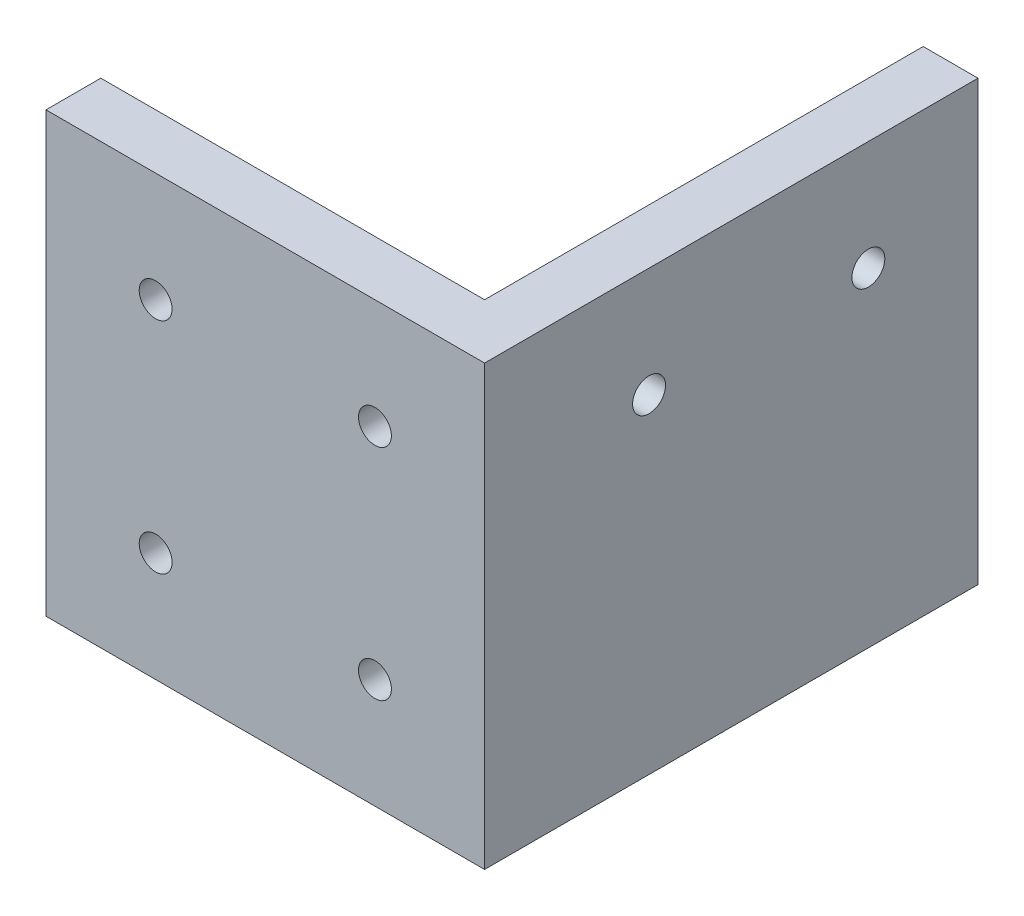
from build123d import *

# Parameters (mm, degrees)
BOSS_EXTRUDE1_DEPTH  = 597.1
SKETCH2_W            = 65.2
SKETCH2_H            = 400
CUT_EXTRUDE1_DEPTH   = 800.095369778
BOSS_EXTRUDE2_DEPTH  = 8
SKETCH4_W            = 525
SKETCH4_H            = 597.1
BOSS_EXTRUDE3_DEPTH  = 7
SKETCH5_W            = 365
SKETCH5_H            = 597.1
CUT_EXTRUDE2_DEPTH   = 10
CUT_EXTRUDE3_REACH   = 802.736
SKETCH6_R            = 2.125
SKETCH7_W            = 20
SKETCH7_H            = 597.1
CUT_EXTRUDE4_DEPTH   = 5
SKETCH8_W            = 55.055493435
SKETCH8_H            = 20
CUT_EXTRUDE6_DEPTH   = 60
BOSS_EXTRUDE4_REACH  = 799.121
SKETCH13_W           = 40
SKETCH13_H           = 15
SKETCH14_W           = 20
SKETCH14_H           = 597.1
CUT_EXTRUDE7_DEPTH   = 5
CUT_EXTRUDE8_REACH   = 802.736
SKETCH15_R           = 1.33
SKETCH16_W           = 35
SKETCH16_H           = 15
CUT_EXTRUDE9_DEPTH   = 60
SKETCH17_W           = 60
SKETCH17_H           = 150
CUT_EXTRUDE10_DEPTH  = 40
SKETCH18_W           = 12
SKETCH18_H           = 16
CUT_EXTRUDE11_DEPTH  = 800.298073312
SKETCH19_W           = 8
SKETCH19_H           = 7
CUT_EXTRUDE12_DEPTH  = 10
CUT_EXTRUDE13_REACH  = 802.736
SKETCH20_R           = 2.75986214
SKETCH20_R_2         = 2.757960919
SKETCH20_R_3         = 2.776094021
SKETCH20_R_4         = 2.751394876
CUT_EXTRUDE14_REACH  = 802.736
SKETCH21_R           = 1.643359813
SKETCH21_R_2         = 1.638913006
SKETCH21_R_3         = 1.644479807
SKETCH21_R_4         = 1.70596398
SKETCH21_R_5         = 1.645380558
SKETCH21_R_6         = 1.646601879
SKETCH21_R_7         = 1.661334202
SKETCH21_R_8         = 1.701244733
CUT_EXTRUDE15_REACH  = 752.719
SKETCH22_W           = 15
SKETCH22_H           = 20
CUT_EXTRUDE16_REACH  = 802.736
SKETCH24_R           = 1.5
SKETCH27_W           = 35
SKETCH27_H           = 15
CUT_EXTRUDE17_DEPTH  = 60
CUT_EXTRUDE18_START  = -60
SKETCH28_W           = 35
SKETCH28_H           = 15
SKETCH28_R           = 1.5
CUT_EXTRUDE18_DEPTH  = 60
SKETCH29_W           = 60
SKETCH29_H           = 150
CUT_EXTRUDE19_DEPTH  = 40
CUT_EXTRUDE20_REACH  = 802.736
SKETCH33_R           = 2.5
SKETCH37_W           = 55
SKETCH37_H           = 20
CUT_EXTRUDE21_DEPTH  = 60
SKETCH39_W           = 5
SKETCH39_H           = 40
BOSS_EXTRUDE6_DEPTH  = 40
SKETCH41_R           = 1.5
CUT_EXTRUDE22_DEPTH  = 799.501603004
SKETCH42_W           = 35
SKETCH42_H           = 15
BOSS_EXTRUDE7_DEPTH  = 60
SKETCH43_W           = 41.147889502
SKETCH43_H           = 41.618954825
SKETCH43_W_2         = 42.4363484
SKETCH43_H_2         = 40
BOSS_EXTRUDE8_DEPTH  = 20
SKETCH44_W           = 49.636924656
SKETCH44_H           = 46.225017069
SKETCH44_W_2         = 46.873520021
BOSS_EXTRUDE9_DEPTH  = 20
SKETCH45_W           = 35
SKETCH45_H           = 15
BOSS_EXTRUDE10_DEPTH = 60
SKETCH46_W           = 5
SKETCH46_H           = 40
BOSS_EXTRUDE11_DEPTH = 40
SKETCH47_R           = 1.5
CUT_EXTRUDE23_DEPTH  = 826.351325194
FILLET1_R            = 5
FILLET2_R            = 5
SKETCH51_W           = 40
SKETCH51_H           = 40
BOSS_EXTRUDE12_DEPTH = 5
SKETCH52_R           = 3
CUT_EXTRUDE26_DEPTH  = 831.93526222
SKETCH53_R           = 3.280439698
BOSS_EXTRUDE13_DEPTH = 570
CUT_EXTRUDE27_START  = -40
SKETCH54_R           = 3.280439698
CUT_EXTRUDE27_DEPTH  = 40
SKETCH55_W           = 485
SKETCH55_H           = 14.478767201
CUT_EXTRUDE28_DEPTH  = 40
SKETCH57_W           = 723.186896727
SKETCH57_H           = 160.707941424
CUT_EXTRUDE30_DEPTH  = 828.51338962
SKETCH60_W           = 40
SKETCH60_H           = 40
BOSS_EXTRUDE15_DEPTH = 5
SKETCH61_R           = 3
CUT_EXTRUDE31_DEPTH  = 5
SKETCH62_W           = 40
SKETCH62_H           = 40
CUT_EXTRUDE32_DEPTH  = 5
SKETCH63_R           = 4.70093443
SKETCH63_R_2         = 1.5
SKETCH63_R_3         = 5.7398541
BOSS_EXTRUDE16_DEPTH = 5
SKETCH64_R           = 3.5
CUT_EXTRUDE33_DEPTH  = 1.5


with BuildPart() as part:
    # Sketch1 → Boss-Extrude1 (new body)
    with BuildSketch(Plane.XY):
        Polygon((0, 95), (0, 0), (237.916666667, 0), (262.5, 0), (262.5, 15), (80, 15), (80, 80), (70, 80), (70, 75), (50, 75), (50, 80), (40, 80), (40, 75), (20, 75), (20, 95), align=None)
        Polygon((262.5, 15), (262.5, 0), (287.083333333, 0), (525, 0), (525, 95), (505, 95), (505, 75), (485, 75), (485, 80), (475, 80), (475, 75), (455, 75), (455, 80), (445, 80), (445, 15), align=None)
    extrude(amount=BOSS_EXTRUDE1_DEPTH)

    # Sketch2 → Cut-Extrude1 (cut, through all)
    with BuildSketch(Plane(origin=(0, 15, 0), x_dir=(1, 0, 0), z_dir=(0, 1, 0))):
        with Locations((219.9, -200)):
            Rectangle(SKETCH2_W, SKETCH2_H)
        with Locations((305.1, -397.1)):
            Rectangle(SKETCH2_W, SKETCH2_H)
    extrude(amount=-CUT_EXTRUDE1_DEPTH, mode=Mode.SUBTRACT)

    # Sketch3 → Boss-Extrude2 (add)
    with BuildSketch(Plane(origin=(0, 15, 0), x_dir=(1, 0, 0), z_dir=(0, 1, 0))):
        Polygon((252.5, -400), (187.3, -400), (187.3, 0), (80, 0), (80, -597.1), (272.5, -597.1), (272.5, -197.1), (337.7, -197.1), (337.7, -597.1), (445, -597.1), (445, 0), (252.5, 0), align=None)
    extrude(amount=BOSS_EXTRUDE2_DEPTH)

    # Sketch4 → Boss-Extrude3 (add)
    with BuildSketch(Plane.XZ):
        with Locations((262.5, 298.55)):
            Rectangle(SKETCH4_W, SKETCH4_H)
    extrude(amount=BOSS_EXTRUDE3_DEPTH)

    # Sketch5 → Cut-Extrude2 (cut)
    with BuildSketch(Plane(origin=(0, 23, 0), x_dir=(1, 0, 0), z_dir=(0, 1, 0))):
        with Locations((262.5, -298.55)):
            Rectangle(SKETCH5_W, SKETCH5_H)
    extrude(amount=-CUT_EXTRUDE2_DEPTH, mode=Mode.SUBTRACT)

    # Sketch6 → Cut-Extrude3 (cut, up to next)
    with BuildSketch(Plane(origin=(525, 0, 0), x_dir=(0, 0, -1), z_dir=(1, 0, 0)), mode=Mode.PRIVATE) as cut_extrude3_sk1:
        with Locations((-318.55, 79)):
            Circle(SKETCH6_R)
    cut_extrude3_tool1 = extrude(cut_extrude3_sk1.sketch, amount=-CUT_EXTRUDE3_REACH, mode=Mode.PRIVATE) & part.part
    # Sketch6 → Cut-Extrude3 (cut, up to next)
    with BuildSketch(Plane(origin=(525, 0, 0), x_dir=(0, 0, -1), z_dir=(1, 0, 0)), mode=Mode.PRIVATE) as cut_extrude3_sk2:
        with Locations((-318.55, 63)):
            Circle(SKETCH6_R)
    cut_extrude3_tool2 = extrude(cut_extrude3_sk2.sketch, amount=-CUT_EXTRUDE3_REACH, mode=Mode.PRIVATE) & part.part
    # Sketch6 → Cut-Extrude3 (cut, up to next)
    with BuildSketch(Plane(origin=(525, 0, 0), x_dir=(0, 0, -1), z_dir=(1, 0, 0)), mode=Mode.PRIVATE) as cut_extrude3_sk3:
        with Locations((-278.55, 63)):
            Circle(SKETCH6_R)
    cut_extrude3_tool3 = extrude(cut_extrude3_sk3.sketch, amount=-CUT_EXTRUDE3_REACH, mode=Mode.PRIVATE) & part.part
    # Sketch6 → Cut-Extrude3 (cut, up to next)
    with BuildSketch(Plane(origin=(525, 0, 0), x_dir=(0, 0, -1), z_dir=(1, 0, 0)), mode=Mode.PRIVATE) as cut_extrude3_sk4:
        with Locations((-278.55, 79)):
            Circle(SKETCH6_R)
    cut_extrude3_tool4 = extrude(cut_extrude3_sk4.sketch, amount=-CUT_EXTRUDE3_REACH, mode=Mode.PRIVATE) & part.part
    add(cut_extrude3_tool1.solids().sort_by_distance((525, 79, 318.55))[0], mode=Mode.SUBTRACT)
    add(cut_extrude3_tool2.solids().sort_by_distance((525, 63, 318.55))[0], mode=Mode.SUBTRACT)
    add(cut_extrude3_tool3.solids().sort_by_distance((525, 63, 278.55))[0], mode=Mode.SUBTRACT)
    add(cut_extrude3_tool4.solids().sort_by_distance((525, 79, 278.55))[0], mode=Mode.SUBTRACT)

    # Sketch7 → Cut-Extrude4 (cut)
    with BuildSketch(Plane(origin=(0, 75, 0), x_dir=(1, 0, 0), z_dir=(0, 1, 0))):
        with Locations((495, -298.55)):
            Rectangle(SKETCH7_W, SKETCH7_H)
    extrude(amount=-CUT_EXTRUDE4_DEPTH, mode=Mode.SUBTRACT)

    # Sketch8 → Cut-Extrude6 (cut)
    with BuildSketch(Plane.ZY.offset(-445)):
        with Locations((297.395302375, 60)):
            Rectangle(SKETCH8_W, SKETCH8_H)
    extrude(amount=-CUT_EXTRUDE6_DEPTH, mode=Mode.SUBTRACT)

    # Sketch13 → Boss-Extrude4 (add, up to next)
    with BuildSketch(Plane(origin=(0, 50, 0), x_dir=(1, 0, 0), z_dir=(0, 1, 0)), mode=Mode.PRIVATE) as boss_extrude4_sk1:
        with Locations((465, -297.800707188)):
            Rectangle(SKETCH13_W, SKETCH13_H)
    boss_extrude4_tool1 = extrude(boss_extrude4_sk1.sketch, amount=BOSS_EXTRUDE4_REACH, mode=Mode.PRIVATE) - part.part
    add(boss_extrude4_tool1.solids().sort_by_distance((465, 50, 297.800707))[0])

    # Sketch14 → Cut-Extrude7 (cut)
    with BuildSketch(Plane(origin=(0, 75, 0), x_dir=(1, 0, 0), z_dir=(0, 1, 0))):
        with Locations((30, -298.55)):
            Rectangle(SKETCH14_W, SKETCH14_H)
    extrude(amount=-CUT_EXTRUDE7_DEPTH, mode=Mode.SUBTRACT)

    # Sketch15 → Cut-Extrude8 (cut, up to next)
    with BuildSketch(Plane.ZY, mode=Mode.PRIVATE) as cut_extrude8_sk1:
        with Locations((13.5, 82.3)):
            Circle(SKETCH15_R)
    cut_extrude8_tool1 = extrude(cut_extrude8_sk1.sketch, amount=-CUT_EXTRUDE8_REACH, mode=Mode.PRIVATE) & part.part
    # Sketch15 → Cut-Extrude8 (cut, up to next)
    with BuildSketch(Plane.ZY, mode=Mode.PRIVATE) as cut_extrude8_sk2:
        with Locations((33.5, 82.3)):
            Circle(SKETCH15_R)
    cut_extrude8_tool2 = extrude(cut_extrude8_sk2.sketch, amount=-CUT_EXTRUDE8_REACH, mode=Mode.PRIVATE) & part.part
    # Sketch15 → Cut-Extrude8 (cut, up to next)
    with BuildSketch(Plane.ZY, mode=Mode.PRIVATE) as cut_extrude8_sk3:
        with Locations((13.5, 62.3)):
            Circle(SKETCH15_R)
    cut_extrude8_tool3 = extrude(cut_extrude8_sk3.sketch, amount=-CUT_EXTRUDE8_REACH, mode=Mode.PRIVATE) & part.part
    # Sketch15 → Cut-Extrude8 (cut, up to next)
    with BuildSketch(Plane.ZY, mode=Mode.PRIVATE) as cut_extrude8_sk4:
        with Locations((33.5, 62.3)):
            Circle(SKETCH15_R)
    cut_extrude8_tool4 = extrude(cut_extrude8_sk4.sketch, amount=-CUT_EXTRUDE8_REACH, mode=Mode.PRIVATE) & part.part
    # Sketch15 → Cut-Extrude8 (cut, up to next)
    with BuildSketch(Plane.ZY, mode=Mode.PRIVATE) as cut_extrude8_sk5:
        with Locations((563.6, 82.3)):
            Circle(SKETCH15_R)
    cut_extrude8_tool5 = extrude(cut_extrude8_sk5.sketch, amount=-CUT_EXTRUDE8_REACH, mode=Mode.PRIVATE) & part.part
    # Sketch15 → Cut-Extrude8 (cut, up to next)
    with BuildSketch(Plane.ZY, mode=Mode.PRIVATE) as cut_extrude8_sk6:
        with Locations((583.6, 62.3)):
            Circle(SKETCH15_R)
    cut_extrude8_tool6 = extrude(cut_extrude8_sk6.sketch, amount=-CUT_EXTRUDE8_REACH, mode=Mode.PRIVATE) & part.part
    # Sketch15 → Cut-Extrude8 (cut, up to next)
    with BuildSketch(Plane.ZY, mode=Mode.PRIVATE) as cut_extrude8_sk7:
        with Locations((563.6, 62.3)):
            Circle(SKETCH15_R)
    cut_extrude8_tool7 = extrude(cut_extrude8_sk7.sketch, amount=-CUT_EXTRUDE8_REACH, mode=Mode.PRIVATE) & part.part
    # Sketch15 → Cut-Extrude8 (cut, up to next)
    with BuildSketch(Plane.ZY, mode=Mode.PRIVATE) as cut_extrude8_sk8:
        with Locations(Location((583.6, 82.3, 0), (0, 0, 90))):
            Circle(SKETCH15_R)
    cut_extrude8_tool8 = extrude(cut_extrude8_sk8.sketch, amount=-CUT_EXTRUDE8_REACH, mode=Mode.PRIVATE) & part.part
    add(cut_extrude8_tool1.solids().sort_by_distance((0, 82.3, 13.5))[0], mode=Mode.SUBTRACT)
    add(cut_extrude8_tool2.solids().sort_by_distance((0, 82.3, 33.5))[0], mode=Mode.SUBTRACT)
    add(cut_extrude8_tool3.solids().sort_by_distance((0, 62.3, 13.5))[0], mode=Mode.SUBTRACT)
    add(cut_extrude8_tool4.solids().sort_by_distance((0, 62.3, 33.5))[0], mode=Mode.SUBTRACT)
    add(cut_extrude8_tool5.solids().sort_by_distance((0, 82.3, 563.6))[0], mode=Mode.SUBTRACT)
    add(cut_extrude8_tool6.solids().sort_by_distance((0, 62.3, 583.6))[0], mode=Mode.SUBTRACT)
    add(cut_extrude8_tool7.solids().sort_by_distance((0, 62.3, 563.6))[0], mode=Mode.SUBTRACT)
    add(cut_extrude8_tool8.solids().sort_by_distance((0, 82.3, 583.6))[0], mode=Mode.SUBTRACT)

    # Sketch16 → Cut-Extrude9 (cut)
    with BuildSketch(Plane(origin=(80, 0, 0), x_dir=(0, 0, -1), z_dir=(1, 0, 0))):
        with Locations((-574.6, 62.5)):
            Rectangle(SKETCH16_W, SKETCH16_H)
        with Locations((-22.5, 62.5)):
            Rectangle(SKETCH16_W, SKETCH16_H)
    extrude(amount=-CUT_EXTRUDE9_DEPTH, mode=Mode.SUBTRACT)

    # Sketch17 → Cut-Extrude10 (cut)
    with BuildSketch(Plane.XZ.offset(7)):
        with Locations((495, 298.55)):
            Rectangle(SKETCH17_W, SKETCH17_H)
    extrude(amount=-CUT_EXTRUDE10_DEPTH, mode=Mode.SUBTRACT)

    # Sketch18 → Cut-Extrude11 (cut, through all)
    with BuildSketch(Plane(origin=(0, 13, 0), x_dir=(1, 0, 0), z_dir=(0, 1, 0))):
        with Locations((421, -294.05)):
            Rectangle(SKETCH18_W, SKETCH18_H)
    extrude(amount=-CUT_EXTRUDE11_DEPTH, mode=Mode.SUBTRACT)

    # Sketch19 → Cut-Extrude12 (cut)
    with BuildSketch(Plane(origin=(0, 13, 0), x_dir=(1, 0, 0), z_dir=(0, 1, 0))):
        with Locations((421, -282.55)):
            Rectangle(SKETCH19_W, SKETCH19_H)
        with Locations((421, -305.55)):
            Rectangle(SKETCH19_W, SKETCH19_H)
    extrude(amount=-CUT_EXTRUDE12_DEPTH, mode=Mode.SUBTRACT)

    # Sketch20 → Cut-Extrude13 (cut, up to next)
    with BuildSketch(Plane(origin=(525, 0, 0), x_dir=(0, 0, -1), z_dir=(1, 0, 0)), mode=Mode.PRIVATE) as cut_extrude13_sk1:
        with Locations((-318.55, 79)):
            Circle(SKETCH20_R)
    cut_extrude13_tool1 = extrude(cut_extrude13_sk1.sketch, amount=-CUT_EXTRUDE13_REACH, mode=Mode.PRIVATE) & part.part
    # Sketch20 → Cut-Extrude13 (cut, up to next)
    with BuildSketch(Plane(origin=(525, 0, 0), x_dir=(0, 0, -1), z_dir=(1, 0, 0)), mode=Mode.PRIVATE) as cut_extrude13_sk2:
        with Locations((-318.55, 63)):
            Circle(SKETCH20_R_2)
    cut_extrude13_tool2 = extrude(cut_extrude13_sk2.sketch, amount=-CUT_EXTRUDE13_REACH, mode=Mode.PRIVATE) & part.part
    # Sketch20 → Cut-Extrude13 (cut, up to next)
    with BuildSketch(Plane(origin=(525, 0, 0), x_dir=(0, 0, -1), z_dir=(1, 0, 0)), mode=Mode.PRIVATE) as cut_extrude13_sk3:
        with Locations((-278.55, 63)):
            Circle(SKETCH20_R_3)
    cut_extrude13_tool3 = extrude(cut_extrude13_sk3.sketch, amount=-CUT_EXTRUDE13_REACH, mode=Mode.PRIVATE) & part.part
    # Sketch20 → Cut-Extrude13 (cut, up to next)
    with BuildSketch(Plane(origin=(525, 0, 0), x_dir=(0, 0, -1), z_dir=(1, 0, 0)), mode=Mode.PRIVATE) as cut_extrude13_sk4:
        with Locations((-278.55, 79)):
            Circle(SKETCH20_R_4)
    cut_extrude13_tool4 = extrude(cut_extrude13_sk4.sketch, amount=-CUT_EXTRUDE13_REACH, mode=Mode.PRIVATE) & part.part
    add(cut_extrude13_tool1.solids().sort_by_distance((525, 79, 318.55))[0], mode=Mode.SUBTRACT)
    add(cut_extrude13_tool2.solids().sort_by_distance((525, 63, 318.55))[0], mode=Mode.SUBTRACT)
    add(cut_extrude13_tool3.solids().sort_by_distance((525, 63, 278.55))[0], mode=Mode.SUBTRACT)
    add(cut_extrude13_tool4.solids().sort_by_distance((525, 79, 278.55))[0], mode=Mode.SUBTRACT)

    # Sketch21 → Cut-Extrude14 (cut, up to next)
    with BuildSketch(Plane.ZY, mode=Mode.PRIVATE) as cut_extrude14_sk1:
        with Locations((13.5, 82.3)):
            Circle(SKETCH21_R)
    cut_extrude14_tool1 = extrude(cut_extrude14_sk1.sketch, amount=-CUT_EXTRUDE14_REACH, mode=Mode.PRIVATE) & part.part
    # Sketch21 → Cut-Extrude14 (cut, up to next)
    with BuildSketch(Plane.ZY, mode=Mode.PRIVATE) as cut_extrude14_sk2:
        with Locations((13.5, 62.3)):
            Circle(SKETCH21_R_2)
    cut_extrude14_tool2 = extrude(cut_extrude14_sk2.sketch, amount=-CUT_EXTRUDE14_REACH, mode=Mode.PRIVATE) & part.part
    # Sketch21 → Cut-Extrude14 (cut, up to next)
    with BuildSketch(Plane.ZY, mode=Mode.PRIVATE) as cut_extrude14_sk3:
        with Locations((33.5, 62.3)):
            Circle(SKETCH21_R_3)
    cut_extrude14_tool3 = extrude(cut_extrude14_sk3.sketch, amount=-CUT_EXTRUDE14_REACH, mode=Mode.PRIVATE) & part.part
    # Sketch21 → Cut-Extrude14 (cut, up to next)
    with BuildSketch(Plane.ZY, mode=Mode.PRIVATE) as cut_extrude14_sk4:
        with Locations((33.5, 82.3)):
            Circle(SKETCH21_R_4)
    cut_extrude14_tool4 = extrude(cut_extrude14_sk4.sketch, amount=-CUT_EXTRUDE14_REACH, mode=Mode.PRIVATE) & part.part
    # Sketch21 → Cut-Extrude14 (cut, up to next)
    with BuildSketch(Plane.ZY, mode=Mode.PRIVATE) as cut_extrude14_sk5:
        with Locations((563.6, 62.3)):
            Circle(SKETCH21_R_5)
    cut_extrude14_tool5 = extrude(cut_extrude14_sk5.sketch, amount=-CUT_EXTRUDE14_REACH, mode=Mode.PRIVATE) & part.part
    # Sketch21 → Cut-Extrude14 (cut, up to next)
    with BuildSketch(Plane.ZY, mode=Mode.PRIVATE) as cut_extrude14_sk6:
        with Locations((583.6, 62.3)):
            Circle(SKETCH21_R_6)
    cut_extrude14_tool6 = extrude(cut_extrude14_sk6.sketch, amount=-CUT_EXTRUDE14_REACH, mode=Mode.PRIVATE) & part.part
    # Sketch21 → Cut-Extrude14 (cut, up to next)
    with BuildSketch(Plane.ZY, mode=Mode.PRIVATE) as cut_extrude14_sk7:
        with Locations((583.6, 82.3)):
            Circle(SKETCH21_R_7)
    cut_extrude14_tool7 = extrude(cut_extrude14_sk7.sketch, amount=-CUT_EXTRUDE14_REACH, mode=Mode.PRIVATE) & part.part
    # Sketch21 → Cut-Extrude14 (cut, up to next)
    with BuildSketch(Plane.ZY, mode=Mode.PRIVATE) as cut_extrude14_sk8:
        with Locations((563.6, 82.3)):
            Circle(SKETCH21_R_8)
    cut_extrude14_tool8 = extrude(cut_extrude14_sk8.sketch, amount=-CUT_EXTRUDE14_REACH, mode=Mode.PRIVATE) & part.part
    add(cut_extrude14_tool1.solids().sort_by_distance((0, 82.3, 13.5))[0], mode=Mode.SUBTRACT)
    add(cut_extrude14_tool2.solids().sort_by_distance((0, 62.3, 13.5))[0], mode=Mode.SUBTRACT)
    add(cut_extrude14_tool3.solids().sort_by_distance((0, 62.3, 33.5))[0], mode=Mode.SUBTRACT)
    add(cut_extrude14_tool4.solids().sort_by_distance((0, 82.3, 33.5))[0], mode=Mode.SUBTRACT)
    add(cut_extrude14_tool5.solids().sort_by_distance((0, 62.3, 563.6))[0], mode=Mode.SUBTRACT)
    add(cut_extrude14_tool6.solids().sort_by_distance((0, 62.3, 583.6))[0], mode=Mode.SUBTRACT)
    add(cut_extrude14_tool7.solids().sort_by_distance((0, 82.3, 583.6))[0], mode=Mode.SUBTRACT)
    add(cut_extrude14_tool8.solids().sort_by_distance((0, 82.3, 563.6))[0], mode=Mode.SUBTRACT)

    # Sketch22 → Cut-Extrude15 (cut, up to next)
    with BuildSketch(Plane.ZY.offset(-445), mode=Mode.PRIVATE) as cut_extrude15_sk1:
        with Locations((297.800707188, 60)):
            Rectangle(SKETCH22_W, SKETCH22_H)
    cut_extrude15_tool1 = extrude(cut_extrude15_sk1.sketch, amount=-CUT_EXTRUDE15_REACH, mode=Mode.PRIVATE) & part.part
    add(cut_extrude15_tool1.solids().sort_by_distance((445, 60, 297.800707))[0], mode=Mode.SUBTRACT)

    # Sketch24 → Cut-Extrude16 (cut, up to next)
    with BuildSketch(Plane(origin=(525, 0, 0), x_dir=(0, 0, -1), z_dir=(1, 0, 0)), mode=Mode.PRIVATE) as cut_extrude16_sk1:
        with Locations((-583.6, 82.3)):
            Circle(SKETCH24_R)
    cut_extrude16_tool1 = extrude(cut_extrude16_sk1.sketch, amount=-CUT_EXTRUDE16_REACH, mode=Mode.PRIVATE) & part.part
    # Sketch24 → Cut-Extrude16 (cut, up to next)
    with BuildSketch(Plane(origin=(525, 0, 0), x_dir=(0, 0, -1), z_dir=(1, 0, 0)), mode=Mode.PRIVATE) as cut_extrude16_sk2:
        with Locations((-563.6, 82.3)):
            Circle(SKETCH24_R)
    cut_extrude16_tool2 = extrude(cut_extrude16_sk2.sketch, amount=-CUT_EXTRUDE16_REACH, mode=Mode.PRIVATE) & part.part
    # Sketch24 → Cut-Extrude16 (cut, up to next)
    with BuildSketch(Plane(origin=(525, 0, 0), x_dir=(0, 0, -1), z_dir=(1, 0, 0)), mode=Mode.PRIVATE) as cut_extrude16_sk3:
        with Locations((-583.6, 62.3)):
            Circle(SKETCH24_R)
    cut_extrude16_tool3 = extrude(cut_extrude16_sk3.sketch, amount=-CUT_EXTRUDE16_REACH, mode=Mode.PRIVATE) & part.part
    # Sketch24 → Cut-Extrude16 (cut, up to next)
    with BuildSketch(Plane(origin=(525, 0, 0), x_dir=(0, 0, -1), z_dir=(1, 0, 0)), mode=Mode.PRIVATE) as cut_extrude16_sk4:
        with Locations((-563.6, 62.3)):
            Circle(SKETCH24_R)
    cut_extrude16_tool4 = extrude(cut_extrude16_sk4.sketch, amount=-CUT_EXTRUDE16_REACH, mode=Mode.PRIVATE) & part.part
    # Sketch24 → Cut-Extrude16 (cut, up to next)
    with BuildSketch(Plane(origin=(525, 0, 0), x_dir=(0, 0, -1), z_dir=(1, 0, 0)), mode=Mode.PRIVATE) as cut_extrude16_sk5:
        with Locations((-33.5, 82.3)):
            Circle(SKETCH24_R)
    cut_extrude16_tool5 = extrude(cut_extrude16_sk5.sketch, amount=-CUT_EXTRUDE16_REACH, mode=Mode.PRIVATE) & part.part
    # Sketch24 → Cut-Extrude16 (cut, up to next)
    with BuildSketch(Plane(origin=(525, 0, 0), x_dir=(0, 0, -1), z_dir=(1, 0, 0)), mode=Mode.PRIVATE) as cut_extrude16_sk6:
        with Locations((-13.5, 82.3)):
            Circle(SKETCH24_R)
    cut_extrude16_tool6 = extrude(cut_extrude16_sk6.sketch, amount=-CUT_EXTRUDE16_REACH, mode=Mode.PRIVATE) & part.part
    # Sketch24 → Cut-Extrude16 (cut, up to next)
    with BuildSketch(Plane(origin=(525, 0, 0), x_dir=(0, 0, -1), z_dir=(1, 0, 0)), mode=Mode.PRIVATE) as cut_extrude16_sk7:
        with Locations((-13.5, 62.3)):
            Circle(SKETCH24_R)
    cut_extrude16_tool7 = extrude(cut_extrude16_sk7.sketch, amount=-CUT_EXTRUDE16_REACH, mode=Mode.PRIVATE) & part.part
    # Sketch24 → Cut-Extrude16 (cut, up to next)
    with BuildSketch(Plane(origin=(525, 0, 0), x_dir=(0, 0, -1), z_dir=(1, 0, 0)), mode=Mode.PRIVATE) as cut_extrude16_sk8:
        with Locations((-33.5, 62.3)):
            Circle(SKETCH24_R)
    cut_extrude16_tool8 = extrude(cut_extrude16_sk8.sketch, amount=-CUT_EXTRUDE16_REACH, mode=Mode.PRIVATE) & part.part
    add(cut_extrude16_tool1.solids().sort_by_distance((525, 82.3, 583.6))[0], mode=Mode.SUBTRACT)
    add(cut_extrude16_tool2.solids().sort_by_distance((525, 82.3, 563.6))[0], mode=Mode.SUBTRACT)
    add(cut_extrude16_tool3.solids().sort_by_distance((525, 62.3, 583.6))[0], mode=Mode.SUBTRACT)
    add(cut_extrude16_tool4.solids().sort_by_distance((525, 62.3, 563.6))[0], mode=Mode.SUBTRACT)
    add(cut_extrude16_tool5.solids().sort_by_distance((525, 82.3, 33.5))[0], mode=Mode.SUBTRACT)
    add(cut_extrude16_tool6.solids().sort_by_distance((525, 82.3, 13.5))[0], mode=Mode.SUBTRACT)
    add(cut_extrude16_tool7.solids().sort_by_distance((525, 62.3, 13.5))[0], mode=Mode.SUBTRACT)
    add(cut_extrude16_tool8.solids().sort_by_distance((525, 62.3, 33.5))[0], mode=Mode.SUBTRACT)

    # Sketch27 → Cut-Extrude17 (cut)
    with BuildSketch(Plane.ZY.offset(-445)):
        with Locations((574.6, 62.5)):
            Rectangle(SKETCH27_W, SKETCH27_H)
    extrude(amount=-CUT_EXTRUDE17_DEPTH, mode=Mode.SUBTRACT)

    # Sketch28 → Cut-Extrude18 (cut)
    with BuildSketch(Plane.ZY.offset(-445).offset(CUT_EXTRUDE18_START)):
        with Locations((22.5, 62.5)):
            Rectangle(SKETCH28_W, SKETCH28_H)
        with Locations(Location((13.5, 62.3, 0), (0, 0, 180))):
            Circle(SKETCH28_R, mode=Mode.SUBTRACT)
        with Locations(Location((33.5, 62.3, 0), (0, 0, 180))):
            Circle(SKETCH28_R, mode=Mode.SUBTRACT)
    extrude(amount=CUT_EXTRUDE18_DEPTH, mode=Mode.SUBTRACT)

    # Sketch29 → Cut-Extrude19 (cut)
    with BuildSketch(Plane.XZ.offset(7)):
        with Locations((30, 298.55)):
            Rectangle(SKETCH29_W, SKETCH29_H)
    extrude(amount=-CUT_EXTRUDE19_DEPTH, mode=Mode.SUBTRACT)

    # Sketch33 → Cut-Extrude20 (cut, up to next)
    with BuildSketch(Plane.ZY, mode=Mode.PRIVATE) as cut_extrude20_sk1:
        with Locations((318.55, 79)):
            Circle(SKETCH33_R)
    cut_extrude20_tool1 = extrude(cut_extrude20_sk1.sketch, amount=-CUT_EXTRUDE20_REACH, mode=Mode.PRIVATE) & part.part
    # Sketch33 → Cut-Extrude20 (cut, up to next)
    with BuildSketch(Plane.ZY, mode=Mode.PRIVATE) as cut_extrude20_sk2:
        with Locations((319.356498111, 63)):
            Circle(SKETCH33_R)
    cut_extrude20_tool2 = extrude(cut_extrude20_sk2.sketch, amount=-CUT_EXTRUDE20_REACH, mode=Mode.PRIVATE) & part.part
    # Sketch33 → Cut-Extrude20 (cut, up to next)
    with BuildSketch(Plane.ZY, mode=Mode.PRIVATE) as cut_extrude20_sk3:
        with Locations((278.55, 79)):
            Circle(SKETCH33_R)
    cut_extrude20_tool3 = extrude(cut_extrude20_sk3.sketch, amount=-CUT_EXTRUDE20_REACH, mode=Mode.PRIVATE) & part.part
    # Sketch33 → Cut-Extrude20 (cut, up to next)
    with BuildSketch(Plane.ZY, mode=Mode.PRIVATE) as cut_extrude20_sk4:
        with Locations((279.356498111, 63)):
            Circle(SKETCH33_R)
    cut_extrude20_tool4 = extrude(cut_extrude20_sk4.sketch, amount=-CUT_EXTRUDE20_REACH, mode=Mode.PRIVATE) & part.part
    add(cut_extrude20_tool1.solids().sort_by_distance((0, 79, 318.55))[0], mode=Mode.SUBTRACT)
    add(cut_extrude20_tool2.solids().sort_by_distance((0, 63, 319.356498))[0], mode=Mode.SUBTRACT)
    add(cut_extrude20_tool3.solids().sort_by_distance((0, 79, 278.55))[0], mode=Mode.SUBTRACT)
    add(cut_extrude20_tool4.solids().sort_by_distance((0, 63, 279.356498))[0], mode=Mode.SUBTRACT)

    # Sketch37 → Cut-Extrude21 (cut)
    with BuildSketch(Plane(origin=(80, 0, 0), x_dir=(0, 0, -1), z_dir=(1, 0, 0))):
        with Locations((-299.68, 60)):
            Rectangle(SKETCH37_W, SKETCH37_H)
    extrude(amount=-CUT_EXTRUDE21_DEPTH, mode=Mode.SUBTRACT)

    # Sketch39 → Boss-Extrude6 (add)
    with BuildSketch(Plane.ZY):
        with Locations((5.5, 75)):
            Rectangle(SKETCH39_W, SKETCH39_H)
        with Locations((591.6, 75)):
            Rectangle(SKETCH39_W, SKETCH39_H)
    extrude(amount=BOSS_EXTRUDE6_DEPTH)

    # Sketch41 → Cut-Extrude22 (cut, through all)
    with BuildSketch(Plane(origin=(0, 0, 3), x_dir=(-1, 0, 0), z_dir=(0, 0, -1))):
        with Locations((10, 85)):
            Circle(SKETCH41_R)
        with Locations((30, 85)):
            Circle(SKETCH41_R)
        with Locations((30, 65)):
            Circle(SKETCH41_R)
        with Locations((10, 65)):
            Circle(SKETCH41_R)
    extrude(amount=-CUT_EXTRUDE22_DEPTH, mode=Mode.SUBTRACT)

    # Sketch42 → Boss-Extrude7 (add)
    with BuildSketch(Plane(origin=(80, 0, 0), x_dir=(0, 0, -1), z_dir=(1, 0, 0))):
        with Locations((-574.6, 62.5)):
            Rectangle(SKETCH42_W, SKETCH42_H)
        with Locations((-22.5, 62.5)):
            Rectangle(SKETCH42_W, SKETCH42_H)
    extrude(amount=-BOSS_EXTRUDE7_DEPTH)

    # Sketch43 → Boss-Extrude8 (add)
    with BuildSketch(Plane.ZY):
        with Locations((28.573944751, 74.190522587)):
            Rectangle(SKETCH43_W, SKETCH43_H)
        with Locations((567.8818258, 75)):
            Rectangle(SKETCH43_W_2, SKETCH43_H_2)
    extrude(amount=-BOSS_EXTRUDE8_DEPTH)

    # Sketch44 → Boss-Extrude9 (add)
    with BuildSketch(Plane(origin=(525, 0, 0), x_dir=(0, 0, -1), z_dir=(1, 0, 0))):
        with Locations((-572.281537672, 71.887491466)):
            Rectangle(SKETCH44_W, SKETCH44_H)
        with Locations((-24.748698221, 71.887491466)):
            Rectangle(SKETCH44_W_2, SKETCH44_H)
    extrude(amount=-BOSS_EXTRUDE9_DEPTH)

    # Sketch45 → Boss-Extrude10 (add)
    with BuildSketch(Plane.ZY.offset(-445)):
        with Locations((22.5, 62.5)):
            Rectangle(SKETCH45_W, SKETCH45_H)
        with Locations((574.6, 62.5)):
            Rectangle(SKETCH45_W, SKETCH45_H)
    extrude(amount=-BOSS_EXTRUDE10_DEPTH)

    # Sketch46 → Boss-Extrude11 (add)
    with BuildSketch(Plane(origin=(525, 0, 0), x_dir=(0, 0, -1), z_dir=(1, 0, 0))):
        with Locations((-591.6, 75)):
            Rectangle(SKETCH46_W, SKETCH46_H)
        with Locations((-5.5, 75)):
            Rectangle(SKETCH46_W, SKETCH46_H)
    extrude(amount=BOSS_EXTRUDE11_DEPTH)

    # Sketch47 → Cut-Extrude23 (cut, through all)
    with BuildSketch(Plane(origin=(0, 0, 3), x_dir=(-1, 0, 0), z_dir=(0, 0, -1))):
        with Locations(Location((-555, 85, 0), (0, 0, 90))):
            Circle(SKETCH47_R)
        with Locations(Location((-535, 84.658315236, 0), (0, 0, 90))):
            Circle(SKETCH47_R)
        with Locations(Location((-535, 64.658315236, 0), (0, 0, 90))):
            Circle(SKETCH47_R)
        with Locations(Location((-555, 65, 0), (0, 0, 90))):
            Circle(SKETCH47_R)
    extrude(amount=-CUT_EXTRUDE23_DEPTH, mode=Mode.SUBTRACT)

    # Fillet1
    fillet1_edges = [part.edges().sort_by_distance(p)[0] for p in [
        (0, 75, 8),
    ]]
    fillet(fillet1_edges, radius=FILLET1_R)

    # Fillet2
    fillet2_edges = [part.edges().sort_by_distance(p)[0] for p in [
        (0, 75, 589.1),
        (525, 75, 589.1),
        (525, 75, 8),
    ]]
    fillet(fillet2_edges, radius=FILLET2_R)

    # Sketch51 → Boss-Extrude12 (add)
    with BuildSketch(Plane.ZY):
        with Locations((28, 75)):
            Rectangle(SKETCH51_W, SKETCH51_H)
    extrude(amount=BOSS_EXTRUDE12_DEPTH)

    # Sketch52 → Cut-Extrude26 (cut, through all)
    with BuildSketch(Plane.ZY.offset(5)):
        with Locations((18, 85)):
            Circle(SKETCH52_R)
        with Locations((28, 85)):
            Circle(SKETCH52_R)
        with Locations((38, 85)):
            Circle(SKETCH52_R)
    extrude(amount=-CUT_EXTRUDE26_DEPTH, mode=Mode.SUBTRACT)

    # Sketch53 → Boss-Extrude13 (add, through all)
    with BuildSketch(Plane.ZY.offset(5)):
        with Locations(Location((28, 85, 0), (0, 0, 90))):
            Circle(SKETCH53_R)
    extrude(amount=-BOSS_EXTRUDE13_DEPTH)

    # Sketch54 → Cut-Extrude27 (cut)
    with BuildSketch(Plane(origin=(565, 0, 0), x_dir=(0, 0, -1), z_dir=(1, 0, 0)).offset(CUT_EXTRUDE27_START)):
        with Locations(Location((-28, 85, 0), (0, 0, 90))):
            Circle(SKETCH54_R)
    extrude(amount=CUT_EXTRUDE27_DEPTH, mode=Mode.SUBTRACT)

    # Sketch55 → Cut-Extrude28 (cut)
    with BuildSketch(Plane(origin=(0, 0, 0), x_dir=(-1, 0, 0), z_dir=(0, 0, -1))):
        with Locations((-262.5, 87.7606164)):
            Rectangle(SKETCH55_W, SKETCH55_H)
    extrude(amount=-CUT_EXTRUDE28_DEPTH, mode=Mode.SUBTRACT)

    # Sketch57 → Cut-Extrude30 (cut, through all)
    with BuildSketch(Plane(origin=(0, 0, 0), x_dir=(-1, 0, 0), z_dir=(0, 0, -1))):
        with Locations((-361.593448364, 14.646029288)):
            Rectangle(SKETCH57_W, SKETCH57_H)
    extrude(amount=-CUT_EXTRUDE30_DEPTH, mode=Mode.SUBTRACT)


with BuildPart() as body_2:
    # of the pieces the cut leaves, the one that is kept (cut_extrude30_keep)
    add(part.part.solids().sort_by_distance((0, 55, 3))[0])

    # Sketch60 → Boss-Extrude15 (add)
    with BuildSketch(Plane(origin=(0, 0, 0), x_dir=(0, 0, -1), z_dir=(1, 0, 0))):
        with Locations((17, 75)):
            Rectangle(SKETCH60_W, SKETCH60_H)
    extrude(amount=-BOSS_EXTRUDE15_DEPTH)

    # Sketch61 → Cut-Extrude31 (cut)
    with BuildSketch(Plane(origin=(0, 0, 0), x_dir=(0, 0, -1), z_dir=(1, 0, 0))):
        with Locations((7, 85)):
            Circle(SKETCH61_R)
        with Locations((27, 85)):
            Circle(SKETCH61_R)
    extrude(amount=-CUT_EXTRUDE31_DEPTH, mode=Mode.SUBTRACT)

    # Sketch62 → Cut-Extrude32 (cut)
    with BuildSketch(Plane.ZY.offset(5)):
        with Locations((28, 75)):
            Rectangle(SKETCH62_W, SKETCH62_H)
    extrude(amount=-CUT_EXTRUDE32_DEPTH, mode=Mode.SUBTRACT)

    # Sketch63 → Boss-Extrude16 (add)
    # profile 1 of 2: a face of its own
    with BuildSketch(Plane.ZY.offset(5)):
        with Locations((-7, 85)):
            Circle(SKETCH63_R)
        with Locations((-7, 85)):
            Circle(SKETCH63_R_2, mode=Mode.SUBTRACT)
    # profile 2 of 2: a face of its own
    with BuildSketch(Plane.ZY.offset(5)):
        with Locations((-27, 85)):
            Circle(SKETCH63_R_3)
        with Locations((-27, 85)):
            Circle(SKETCH63_R_2, mode=Mode.SUBTRACT)
    extrude(amount=-BOSS_EXTRUDE16_DEPTH)

    # Sketch64 → Cut-Extrude33 (cut)
    with BuildSketch(Plane.ZY.offset(5)):
        with Locations((-27, 85)):
            Circle(SKETCH64_R)
        with Locations((-7, 85)):
            Circle(SKETCH64_R)
    extrude(amount=-CUT_EXTRUDE33_DEPTH, mode=Mode.SUBTRACT)


solid = body_2.part
